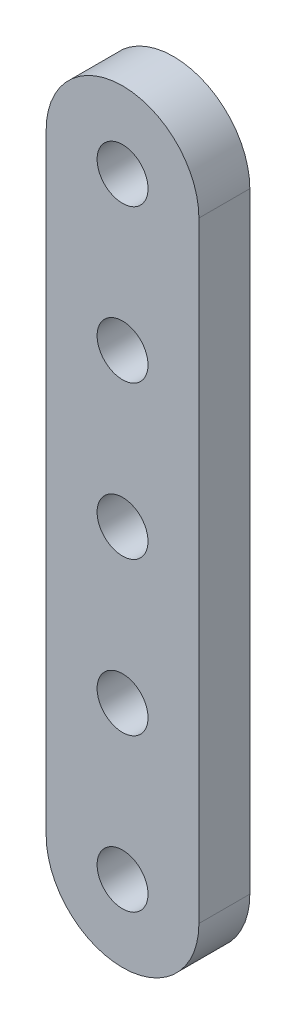
from build123d import *

# Parameters (mm, degrees)
MODEL_R                 = 1.5
SALIENTE_EXTRUIR1_DEPTH = 3


with BuildPart() as part:
    # Model → Saliente-Extruir1 (new body)
    with BuildSketch(Plane.XY):
        with BuildLine():
            Line((213.25077615, 152.428489513), (213.25077615, 188.428489513))
            ThreePointArc((213.25077615, 188.428489513), (208.75077615, 192.928489513), (204.25077615, 188.428489513))
            Line((204.25077615, 188.428489513), (204.25077615, 152.428489513))
            ThreePointArc((204.25077615, 152.428489513), (208.75077615, 147.928489513), (213.25077615, 152.428489513))
        make_face()
        with Locations((208.75077615, 179.428489513)):
            Circle(MODEL_R, mode=Mode.SUBTRACT)
        with Locations((208.75077615, 188.428489513)):
            Circle(MODEL_R, mode=Mode.SUBTRACT)
        with Locations((208.75077615, 152.428489513)):
            Circle(MODEL_R, mode=Mode.SUBTRACT)
        with Locations((208.75077615, 161.428489513)):
            Circle(MODEL_R, mode=Mode.SUBTRACT)
        with Locations((208.75077615, 170.428489513)):
            Circle(MODEL_R, mode=Mode.SUBTRACT)
    extrude(amount=SALIENTE_EXTRUIR1_DEPTH)


solid = part.part
